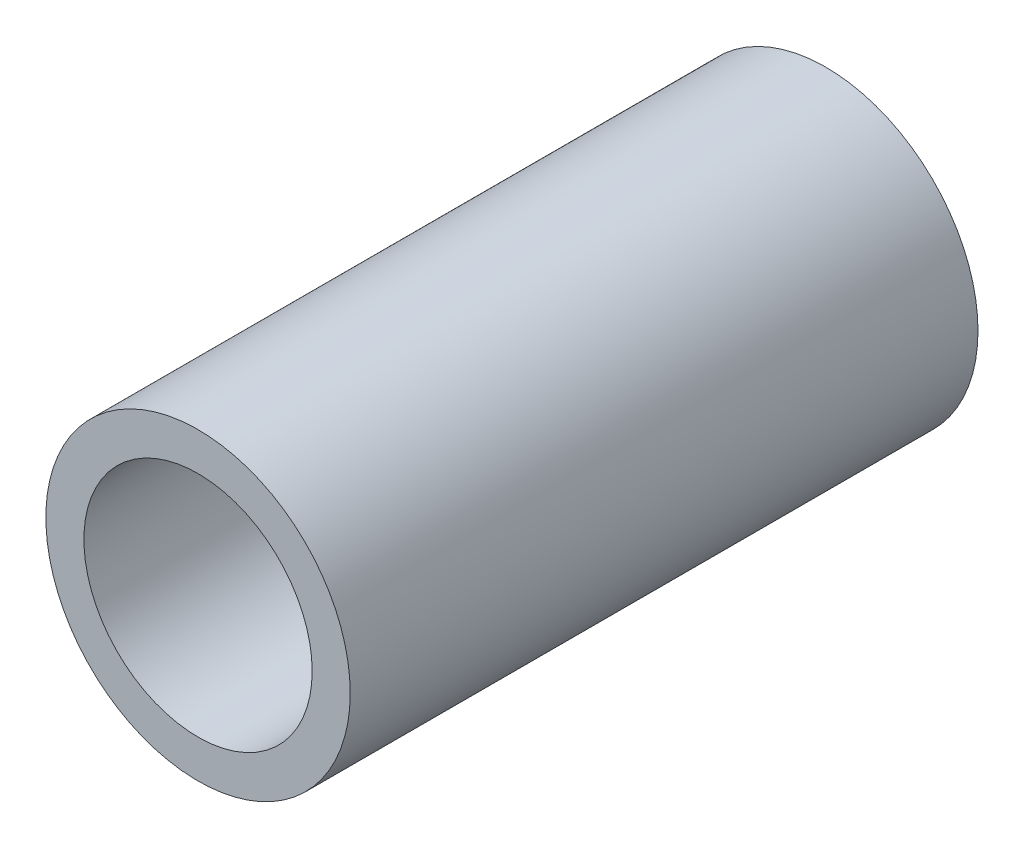
from build123d import *

# Parameters (mm, degrees)
SKIZZE1_R                       = 4
SKIZZE1_R_2                     = 3
AUFSATZ_LINEAR_AUSTRAGEN1_DEPTH = 16.5


with BuildPart() as part:
    # Skizze1 → Aufsatz-Linear austragen1 (new body)
    with BuildSketch(Plane(origin=(0, 0, 0), x_dir=(0, 1, 0), z_dir=(0, 0, 1))):
        with Locations(Location((0, 0, 0), (0, 0, 270))):
            Circle(SKIZZE1_R)
        with Locations(Location((0, 0, 0), (0, 0, 270))):
            Circle(SKIZZE1_R_2, mode=Mode.SUBTRACT)
    extrude(amount=AUFSATZ_LINEAR_AUSTRAGEN1_DEPTH)


solid = part.part
